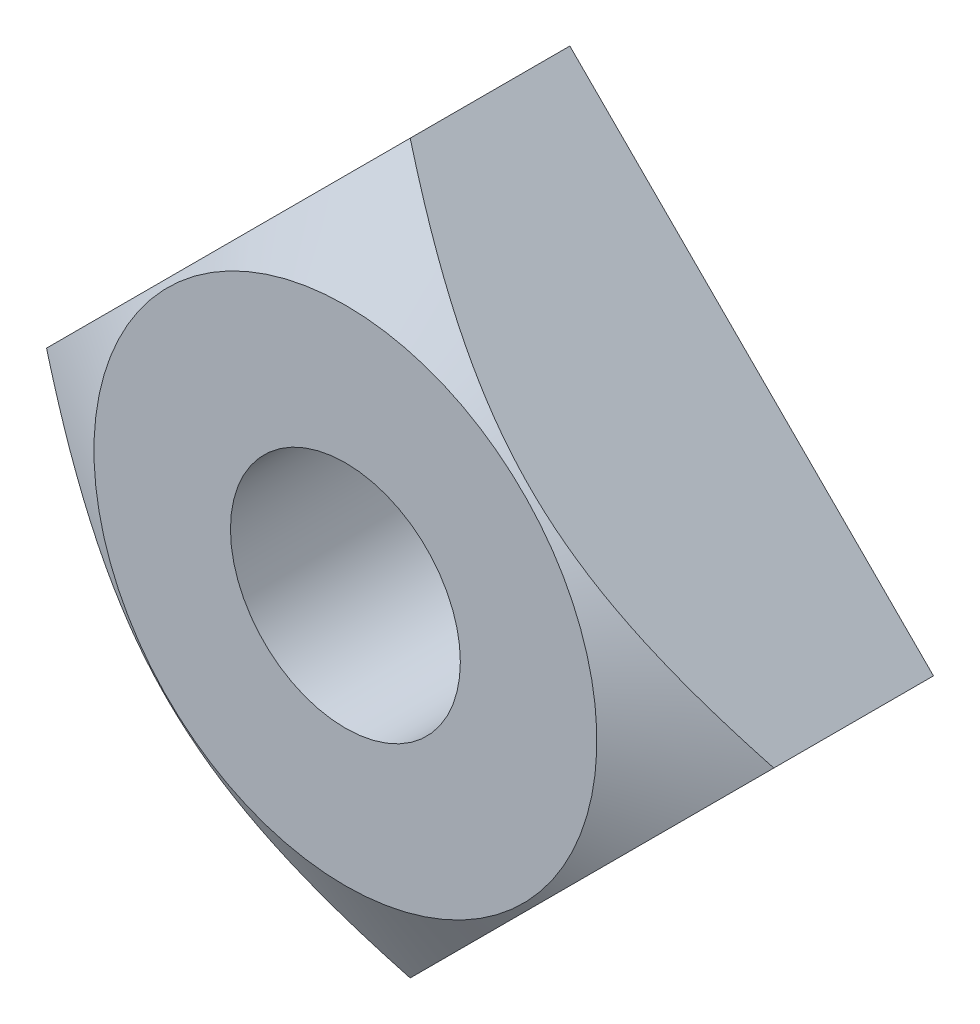
from build123d import *

# Parameters (mm, degrees)
SKETCH_7_R      = 1.229375
EXTRUDE_1_DEPTH = 2.4


with BuildPart() as part:
    # 草图7 → 凸台-拉伸1 (new body)
    with BuildSketch(Plane.XY):
        Polygon((-3.889087297, 0), (0, 3.889087297), (3.889087297, 0), (0, -3.889087297), align=None)
        Circle(SKETCH_7_R, mode=Mode.SUBTRACT)
    extrude(amount=-EXTRUDE_1_DEPTH)

    # 草图8 → 切除-旋转1 (revolve, cut)
    with BuildSketch(Plane(origin=(0, 0, 0), x_dir=(0, 0, -1), z_dir=(1, 0, 0))):
        Polygon((0.692820323, 3.889087297), (0, 2.689087297), (0, 3.889087297), align=None)
    revolve(axis=Axis((0, 0, 0), (0, 0, -1)), mode=Mode.SUBTRACT)


solid = part.part
